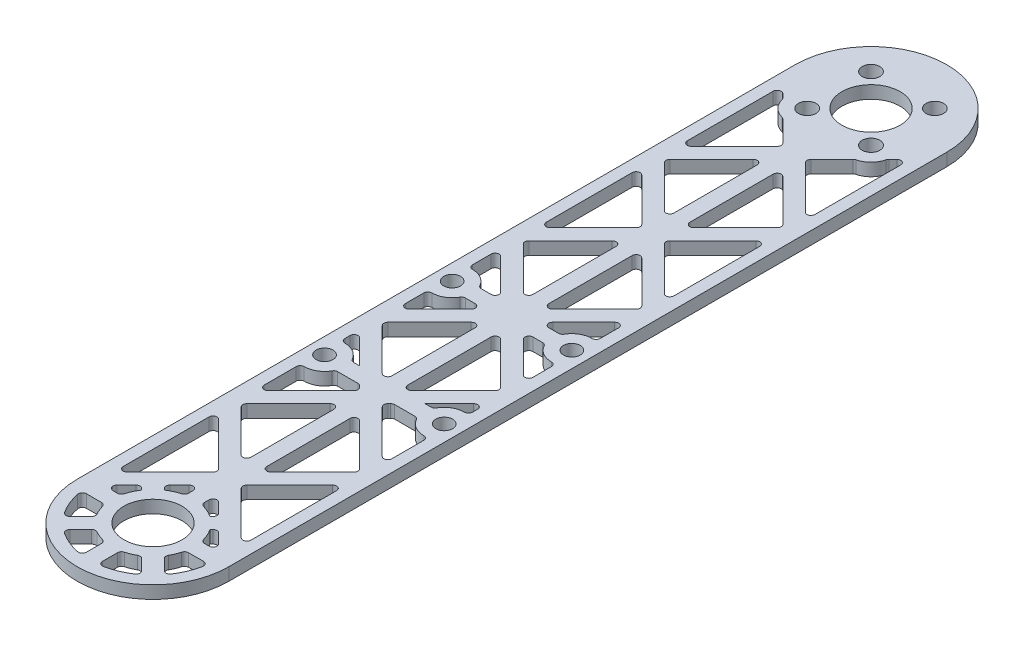
from build123d import *

# Parameters (mm, degrees)
SKETCH1_R           = 7.3
SKETCH1_R_2         = 2.2
SKETCH1_R_3         = 2.1
BOSS_EXTRUDE2_DEPTH = 3.175
CUT_EXTRUDE1_DEPTH  = 3.175


with BuildPart() as part:
    # Sketch1 → Boss-Extrude2 (new body)
    with BuildSketch(Plane(origin=(0, 0, 0), x_dir=(1, 0, 0), z_dir=(0, 1, 0))):
        with BuildLine():
            Line((-19, 90), (-19, -90))
            ThreePointArc((-19, -90), (0, -109), (19, -90))
            Line((19, -90), (19, 90))
            ThreePointArc((19, 90), (0, 109), (-19, 90))
        make_face()
        with Locations(Location((0, 90, 0), (0, 0, 270))):
            Circle(SKETCH1_R, mode=Mode.SUBTRACT)
        with Locations(Location((0, -90, 0), (0, 0, 270))):
            Circle(SKETCH1_R, mode=Mode.SUBTRACT)
        with Locations(Location((-8, 98, 0), (0, 0, 270))):
            Circle(SKETCH1_R_2, mode=Mode.SUBTRACT)
        with Locations(Location((8, 98, 0), (0, 0, 270))):
            Circle(SKETCH1_R_2, mode=Mode.SUBTRACT)
        with Locations(Location((-8, 82, 0), (0, 0, 270))):
            Circle(SKETCH1_R_2, mode=Mode.SUBTRACT)
        with Locations(Location((8, 82, 0), (0, 0, 270))):
            Circle(SKETCH1_R_2, mode=Mode.SUBTRACT)
        with Locations(Location((15, 0, 0), (0, 0, 270))):
            Circle(SKETCH1_R_3, mode=Mode.SUBTRACT)
        with Locations(Location((15, -32, 0), (0, 0, 270))):
            Circle(SKETCH1_R_3, mode=Mode.SUBTRACT)
        with Locations(Location((-15, 0, 0), (0, 0, 270))):
            Circle(SKETCH1_R_3, mode=Mode.SUBTRACT)
        with Locations(Location((-15, -32, 0), (0, 0, 270))):
            Circle(SKETCH1_R_3, mode=Mode.SUBTRACT)
    extrude(amount=BOSS_EXTRUDE2_DEPTH)

    # Sketch2 → Cut-Extrude1 (cut)
    with BuildSketch(Plane(origin=(0, 3.175, 0), x_dir=(1, 0, 0), z_dir=(0, 1, 0))):
        with BuildLine():
            Line((-16, 46.112698372), (-16, 24.597979746))
            ThreePointArc((-16, 24.597979746), (-15.382683432, 23.674100214), (-14.292893219, 23.890872965))
            Line((-14.292893219, 23.890872965), (-3.535533906, 34.648232278))
            ThreePointArc((-3.535533906, 34.648232278), (-3.242640687, 35.355339059), (-3.535533906, 36.062445841))
            Line((-3.535533906, 36.062445841), (-14.292893219, 46.819805153))
            ThreePointArc((-14.292893219, 46.819805153), (-15.382683432, 47.036577905), (-16, 46.112698372))
        make_face()
        with BuildLine():
            Line((-3.707106781, 28.819805153), (-14.142135624, 18.384776311))
            ThreePointArc((-14.142135624, 18.384776311), (-14.435028843, 17.67766953), (-14.142135624, 16.970562748))
            Line((-14.142135624, 16.970562748), (-3.707106781, 6.535533906))
            ThreePointArc((-3.707106781, 6.535533906), (-2.617316568, 6.318761155), (-2, 7.242640687))
            Line((-2, 7.242640687), (-2, 28.112698372))
            ThreePointArc((-2, 28.112698372), (-2.617316568, 29.036577905), (-3.707106781, 28.819805153))
        make_face()
        with BuildLine():
            Line((16, -10.757359313), (16, -6.1))
            ThreePointArc((16, -6.1), (15.707106781, -5.392893219), (15, -5.1))
            ThreePointArc((15, -5.1), (12.429183328, -4.404645461), (10.559397653, -2.508196721))
            ThreePointArc((10.559397653, -2.508196721), (10.19277301, -2.136344027), (9.68869131, -2))
            Line((9.68869131, -2), (7.242640687, -2))
            ThreePointArc((7.242640687, -2), (6.318761155, -2.617316568), (6.535533906, -3.707106781))
            Line((6.535533906, -3.707106781), (14.292893219, -11.464466094))
            ThreePointArc((14.292893219, -11.464466094), (15.382683432, -11.681238845), (16, -10.757359313))
        make_face()
        with BuildLine():
            Line((16, 10.757359313), (16, 6.1))
            ThreePointArc((16, 6.1), (15.707106781, 5.392893219), (15, 5.1))
            ThreePointArc((15, 5.1), (12.429183328, 4.404645461), (10.559397653, 2.508196721))
            ThreePointArc((10.559397653, 2.508196721), (10.19277301, 2.136344027), (9.68869131, 2))
            Line((9.68869131, 2), (7.242640687, 2))
            ThreePointArc((7.242640687, 2), (6.318761155, 2.617316568), (6.535533906, 3.707106781))
            Line((6.535533906, 3.707106781), (14.292893219, 11.464466094))
            ThreePointArc((14.292893219, 11.464466094), (15.382683432, 11.681238845), (16, 10.757359313))
        make_face()
        with BuildLine():
            Line((2, -7.242640687), (2, -28.112698372))
            ThreePointArc((2, -28.112698372), (2.617316568, -29.036577905), (3.707106781, -28.819805153))
            Line((3.707106781, -28.819805153), (14.142135624, -18.384776311))
            ThreePointArc((14.142135624, -18.384776311), (14.435028843, -17.67766953), (14.142135624, -16.970562748))
            Line((14.142135624, -16.970562748), (3.707106781, -6.535533906))
            ThreePointArc((3.707106781, -6.535533906), (2.617316568, -6.318761155), (2, -7.242640687))
        make_face()
        with BuildLine():
            Line((2, -42.597979747), (2, -63.468037432))
            ThreePointArc((2, -63.468037432), (2.617316568, -64.391916964), (3.707106781, -64.175144213))
            Line((3.707106781, -64.175144213), (14.142135624, -53.74011537))
            ThreePointArc((14.142135624, -53.74011537), (14.435028843, -53.033008589), (14.142135624, -52.325901808))
            Line((14.142135624, -52.325901808), (3.707106781, -41.890872965))
            ThreePointArc((3.707106781, -41.890872965), (2.617316568, -41.674100214), (2, -42.597979747))
        make_face()
        with BuildLine():
            Line((16, -59.953318806), (16, -81.468037431))
            ThreePointArc((16, -81.468037431), (15.382683432, -82.391916964), (14.292893219, -82.175144213))
            Line((14.292893219, -82.175144213), (3.535533906, -71.4177849))
            ThreePointArc((3.535533906, -71.4177849), (3.242640687, -70.710678119), (3.535533906, -70.003571337))
            Line((3.535533906, -70.003571337), (14.292893219, -59.246212025))
            ThreePointArc((14.292893219, -59.246212025), (15.382683432, -59.029439273), (16, -59.953318806))
        make_face()
        with BuildLine():
            Line((2, -77.953318806), (2, -79.105505978))
            ThreePointArc((2, -79.105505978), (2.204548328, -79.711523005), (2.734513274, -80.069620493))
            ThreePointArc((2.734513274, -80.069620493), (4.287639599, -80.634844013), (5.730364802, -81.441208074))
            Line((5.730364802, -81.441208074), (6.109127035, -81.062445841))
            ThreePointArc((6.109127035, -81.062445841), (6.402020254, -80.355339059), (6.109127035, -79.648232278))
            Line((6.109127035, -79.648232278), (3.707106781, -77.246212025))
            ThreePointArc((3.707106781, -77.246212025), (2.617316568, -77.029439273), (2, -77.953318806))
        make_face()
        with BuildLine():
            Line((8.937554159, -83.890872965), (8.558791926, -84.269635198))
            ThreePointArc((8.558791926, -84.269635198), (9.365155987, -85.712360401), (9.930379507, -87.265486726))
            ThreePointArc((9.930379507, -87.265486726), (10.288476995, -87.795451672), (10.894494022, -88))
            Line((10.894494022, -88), (12.046681194, -88))
            ThreePointArc((12.046681194, -88), (12.970560727, -87.382683432), (12.753787975, -86.292893219))
            Line((12.753787975, -86.292893219), (10.351767722, -83.890872965))
            ThreePointArc((10.351767722, -83.890872965), (9.644660941, -83.597979746), (8.937554159, -83.890872965))
        make_face()
        with BuildLine():
            Line((9.117784163, -96.289357038), (11.806518408, -98.978091283))
            ThreePointArc((11.806518408, -98.978091283), (12.614134151, -99.265920655), (13.347866868, -98.822383469))
            ThreePointArc((13.347866868, -98.822383469), (14.78207252, -96.122934918), (15.676734354, -93.2))
            ThreePointArc((15.676734354, -93.2), (15.471535126, -92.367544468), (14.696938457, -92))
            Line((14.696938457, -92), (10.894494022, -92))
            ThreePointArc((10.894494022, -92), (10.288476995, -92.204548328), (9.930379507, -92.734513274))
            ThreePointArc((9.930379507, -92.734513274), (9.515959185, -93.941639353), (8.955431569, -95.08824581))
            ThreePointArc((8.955431569, -95.08824581), (8.833902923, -95.716200779), (9.117784163, -96.289357038))
        make_face()
        with BuildLine():
            Line((2, -100.894494022), (2, -104.696938457))
            ThreePointArc((2, -104.696938457), (2.367544468, -105.471535126), (3.2, -105.676734354))
            ThreePointArc((3.2, -105.676734354), (6.122934918, -104.78207252), (8.822383469, -103.347866868))
            ThreePointArc((8.822383469, -103.347866868), (9.265920655, -102.614134151), (8.978091283, -101.806518408))
            Line((8.978091283, -101.806518408), (6.289357038, -99.117784163))
            ThreePointArc((6.289357038, -99.117784163), (5.716200779, -98.833902923), (5.08824581, -98.955431569))
            ThreePointArc((5.08824581, -98.955431569), (3.941639353, -99.515959185), (2.734513274, -99.930379507))
            ThreePointArc((2.734513274, -99.930379507), (2.204548328, -100.288476995), (2, -100.894494022))
        make_face()
        with BuildLine():
            Line((-3.707106781, -28.819805153), (-14.142135624, -18.384776311))
            ThreePointArc((-14.142135624, -18.384776311), (-14.435028843, -17.67766953), (-14.142135624, -16.970562748))
            Line((-14.142135624, -16.970562748), (-3.707106781, -6.535533906))
            ThreePointArc((-3.707106781, -6.535533906), (-2.617316568, -6.318761155), (-2, -7.242640687))
            Line((-2, -7.242640687), (-2, -28.112698372))
            ThreePointArc((-2, -28.112698372), (-2.617316568, -29.036577905), (-3.707106781, -28.819805153))
        make_face()
        with BuildLine():
            Line((-2, -42.597979747), (-2, -63.468037432))
            ThreePointArc((-2, -63.468037432), (-2.617316568, -64.391916964), (-3.707106781, -64.175144213))
            Line((-3.707106781, -64.175144213), (-14.142135624, -53.74011537))
            ThreePointArc((-14.142135624, -53.74011537), (-14.435028843, -53.033008589), (-14.142135624, -52.325901808))
            Line((-14.142135624, -52.325901808), (-3.707106781, -41.890872965))
            ThreePointArc((-3.707106781, -41.890872965), (-2.617316568, -41.674100214), (-2, -42.597979747))
        make_face()
        with BuildLine():
            Line((-14.292893219, -82.175144213), (-3.535533906, -71.4177849))
            ThreePointArc((-3.535533906, -71.4177849), (-3.242640687, -70.710678119), (-3.535533906, -70.003571337))
            Line((-3.535533906, -70.003571337), (-14.292893219, -59.246212025))
            ThreePointArc((-14.292893219, -59.246212025), (-15.382683432, -59.029439273), (-16, -59.953318806))
            Line((-16, -59.953318806), (-16, -81.468037431))
            ThreePointArc((-16, -81.468037431), (-15.382683432, -82.391916964), (-14.292893219, -82.175144213))
        make_face()
        with BuildLine():
            Line((-2, -77.953318806), (-2, -79.105505978))
            ThreePointArc((-2, -79.105505978), (-2.204548328, -79.711523005), (-2.734513274, -80.069620493))
            ThreePointArc((-2.734513274, -80.069620493), (-4.287639599, -80.634844013), (-5.730364802, -81.441208074))
            Line((-5.730364802, -81.441208074), (-6.109127035, -81.062445841))
            ThreePointArc((-6.109127035, -81.062445841), (-6.402020254, -80.355339059), (-6.109127035, -79.648232278))
            Line((-6.109127035, -79.648232278), (-3.707106781, -77.246212025))
            ThreePointArc((-3.707106781, -77.246212025), (-2.617316568, -77.029439273), (-2, -77.953318806))
        make_face()
        with BuildLine():
            Line((-2, -100.894494022), (-2, -104.696938457))
            ThreePointArc((-2, -104.696938457), (-2.367544468, -105.471535126), (-3.2, -105.676734354))
            ThreePointArc((-3.2, -105.676734354), (-6.122934918, -104.78207252), (-8.822383469, -103.347866868))
            ThreePointArc((-8.822383469, -103.347866868), (-9.265920655, -102.614134151), (-8.978091283, -101.806518408))
            Line((-8.978091283, -101.806518408), (-6.289357038, -99.117784163))
            ThreePointArc((-6.289357038, -99.117784163), (-5.716200779, -98.833902923), (-5.08824581, -98.955431569))
            ThreePointArc((-5.08824581, -98.955431569), (-3.941639353, -99.515959185), (-2.734513274, -99.930379507))
            ThreePointArc((-2.734513274, -99.930379507), (-2.204548328, -100.288476995), (-2, -100.894494022))
        make_face()
        with BuildLine():
            Line((-7.242640687, -2), (-9.68869131, -2))
            ThreePointArc((-9.68869131, -2), (-10.19277301, -2.136344027), (-10.559397653, -2.508196721))
            ThreePointArc((-10.559397653, -2.508196721), (-12.429183328, -4.404645461), (-15, -5.1))
            ThreePointArc((-15, -5.1), (-15.707106781, -5.392893219), (-16, -6.1))
            Line((-16, -6.1), (-16, -10.757359313))
            ThreePointArc((-16, -10.757359313), (-15.382683432, -11.681238845), (-14.292893219, -11.464466094))
            Line((-14.292893219, -11.464466094), (-6.535533906, -3.707106781))
            ThreePointArc((-6.535533906, -3.707106781), (-6.318761155, -2.617316568), (-7.242640687, -2))
        make_face()
        with BuildLine():
            Line((-16, 10.757359313), (-16, 6.1))
            ThreePointArc((-16, 6.1), (-15.707106781, 5.392893219), (-15, 5.1))
            ThreePointArc((-15, 5.1), (-12.429183328, 4.404645461), (-10.559397653, 2.508196721))
            ThreePointArc((-10.559397653, 2.508196721), (-10.19277301, 2.136344027), (-9.68869131, 2))
            Line((-9.68869131, 2), (-7.242640687, 2))
            ThreePointArc((-7.242640687, 2), (-6.318761155, 2.617316568), (-6.535533906, 3.707106781))
            Line((-6.535533906, 3.707106781), (-14.292893219, 11.464466094))
            ThreePointArc((-14.292893219, 11.464466094), (-15.382683432, 11.681238845), (-16, 10.757359313))
        make_face()
        with BuildLine():
            Line((-10.894494022, -92), (-14.696938457, -92))
            ThreePointArc((-14.696938457, -92), (-15.471535126, -92.367544468), (-15.676734354, -93.2))
            ThreePointArc((-15.676734354, -93.2), (-14.78207252, -96.122934918), (-13.347866868, -98.822383469))
            ThreePointArc((-13.347866868, -98.822383469), (-12.614134151, -99.265920655), (-11.806518408, -98.978091283))
            Line((-11.806518408, -98.978091283), (-9.117784163, -96.289357038))
            ThreePointArc((-9.117784163, -96.289357038), (-8.833902923, -95.716200779), (-8.955431569, -95.08824581))
            ThreePointArc((-8.955431569, -95.08824581), (-9.515959185, -93.941639353), (-9.930379507, -92.734513274))
            ThreePointArc((-9.930379507, -92.734513274), (-10.288476995, -92.204548328), (-10.894494022, -92))
        make_face()
        with BuildLine():
            Line((-8.937554159, -83.890872965), (-8.558791926, -84.269635198))
            ThreePointArc((-8.558791926, -84.269635198), (-9.365155987, -85.712360401), (-9.930379507, -87.265486726))
            ThreePointArc((-9.930379507, -87.265486726), (-10.288476995, -87.795451672), (-10.894494022, -88))
            Line((-10.894494022, -88), (-12.046681194, -88))
            ThreePointArc((-12.046681194, -88), (-12.970560727, -87.382683432), (-12.753787975, -86.292893219))
            Line((-12.753787975, -86.292893219), (-10.351767722, -83.890872965))
            ThreePointArc((-10.351767722, -83.890872965), (-9.644660941, -83.597979746), (-8.937554159, -83.890872965))
        make_face()
        with BuildLine():
            Line((-16, -24.597979746), (-16, -25.9))
            ThreePointArc((-16, -25.9), (-15.707106781, -26.607106781), (-15, -26.9))
            ThreePointArc((-15, -26.9), (-12.429183328, -27.595354539), (-10.559397653, -29.491803279))
            ThreePointArc((-10.559397653, -29.491803279), (-10.19277301, -29.863655973), (-9.68869131, -30))
            Line((-9.68869131, -30), (-8.183766184, -30))
            Line((-8.183766184, -30), (-14.292893219, -23.890872965))
            ThreePointArc((-14.292893219, -23.890872965), (-15.382683432, -23.674100214), (-16, -24.597979746))
        make_face()
        with BuildLine():
            Line((-9.68869131, -34), (-4.597979746, -34))
            ThreePointArc((-4.597979746, -34), (-4.215296314, -34.076120468), (-3.890872965, -34.292893219))
            Line((-3.890872965, -34.292893219), (-3.535533906, -34.648232278))
            ThreePointArc((-3.535533906, -34.648232278), (-3.242640687, -35.355339059), (-3.535533906, -36.062445841))
            Line((-3.535533906, -36.062445841), (-14.292893219, -46.819805153))
            ThreePointArc((-14.292893219, -46.819805153), (-15.382683432, -47.036577905), (-16, -46.112698372))
            Line((-16, -46.112698372), (-16, -38.1))
            ThreePointArc((-16, -38.1), (-15.707106781, -37.392893219), (-15, -37.1))
            ThreePointArc((-15, -37.1), (-12.429183328, -36.404645461), (-10.559397653, -34.508196721))
            ThreePointArc((-10.559397653, -34.508196721), (-10.19277301, -34.136344027), (-9.68869131, -34))
        make_face()
        with BuildLine():
            Line((16, -24.597979746), (16, -25.9))
            ThreePointArc((16, -25.9), (15.707106781, -26.607106781), (15, -26.9))
            ThreePointArc((15, -26.9), (12.429183328, -27.595354539), (10.559397653, -29.491803279))
            ThreePointArc((10.559397653, -29.491803279), (10.19277301, -29.863655973), (9.68869131, -30))
            Line((9.68869131, -30), (8.183766184, -30))
            Line((8.183766184, -30), (14.292893219, -23.890872965))
            ThreePointArc((14.292893219, -23.890872965), (15.382683432, -23.674100214), (16, -24.597979746))
        make_face()
        with BuildLine():
            Line((16, -46.112698372), (16, -38.1))
            ThreePointArc((16, -38.1), (15.707106781, -37.392893219), (15, -37.1))
            ThreePointArc((15, -37.1), (12.429183328, -36.404645461), (10.559397653, -34.508196721))
            ThreePointArc((10.559397653, -34.508196721), (10.19277301, -34.136344027), (9.68869131, -34))
            Line((9.68869131, -34), (4.597979746, -34))
            ThreePointArc((4.597979746, -34), (4.215296314, -34.076120468), (3.890872965, -34.292893219))
            Line((3.890872965, -34.292893219), (3.535533906, -34.648232278))
            ThreePointArc((3.535533906, -34.648232278), (3.242640687, -35.355339059), (3.535533906, -36.062445841))
            Line((3.535533906, -36.062445841), (14.292893219, -46.819805153))
            ThreePointArc((14.292893219, -46.819805153), (15.382683432, -47.036577905), (16, -46.112698372))
        make_face()
        with BuildLine():
            Line((-3.707106781, 64.175144213), (-14.142135624, 53.74011537))
            ThreePointArc((-14.142135624, 53.74011537), (-14.435028843, 53.033008589), (-14.142135624, 52.325901808))
            Line((-14.142135624, 52.325901808), (-3.707106781, 41.890872965))
            ThreePointArc((-3.707106781, 41.890872965), (-2.617316568, 41.674100214), (-2, 42.597979746))
            Line((-2, 42.597979746), (-2, 63.468037431))
            ThreePointArc((-2, 63.468037431), (-2.617316568, 64.391916964), (-3.707106781, 64.175144213))
        make_face()
        with BuildLine():
            Line((-16, 81.468037432), (-16, 59.953318806))
            ThreePointArc((-16, 59.953318806), (-15.382683432, 59.029439273), (-14.292893219, 59.246212025))
            Line((-14.292893219, 59.246212025), (-3.535533906, 70.003571337))
            ThreePointArc((-3.535533906, 70.003571337), (-3.242640687, 70.710678119), (-3.535533906, 71.4177849))
            Line((-3.535533906, 71.4177849), (-8.814462561, 76.696713555))
            ThreePointArc((-8.814462561, 76.696713555), (-9.02757948, 76.859074436), (-9.276154932, 76.959025036))
            ThreePointArc((-9.276154932, 76.959025036), (-11.676955262, 78.323044738), (-13.040974964, 80.723845068))
            ThreePointArc((-13.040974964, 80.723845068), (-13.140925564, 80.97242052), (-13.303286445, 81.185537439))
            Line((-13.303286445, 81.185537439), (-14.292893219, 82.175144213))
            ThreePointArc((-14.292893219, 82.175144213), (-15.382683432, 82.391916964), (-16, 81.468037432))
        make_face()
        with BuildLine():
            Line((14.142135624, 16.970562748), (3.707106781, 6.535533906))
            ThreePointArc((3.707106781, 6.535533906), (2.617316568, 6.318761155), (2, 7.242640687))
            Line((2, 7.242640687), (2, 28.112698372))
            ThreePointArc((2, 28.112698372), (2.617316568, 29.036577905), (3.707106781, 28.819805153))
            Line((3.707106781, 28.819805153), (14.142135624, 18.384776311))
            ThreePointArc((14.142135624, 18.384776311), (14.435028843, 17.67766953), (14.142135624, 16.970562748))
        make_face()
        with BuildLine():
            Line((14.292893219, 23.890872965), (3.535533906, 34.648232278))
            ThreePointArc((3.535533906, 34.648232278), (3.242640687, 35.355339059), (3.535533906, 36.062445841))
            Line((3.535533906, 36.062445841), (14.292893219, 46.819805153))
            ThreePointArc((14.292893219, 46.819805153), (15.382683432, 47.036577905), (16, 46.112698372))
            Line((16, 46.112698372), (16, 24.597979746))
            ThreePointArc((16, 24.597979746), (15.382683432, 23.674100214), (14.292893219, 23.890872965))
        make_face()
        with BuildLine():
            Line((14.142135624, 52.325901808), (3.707106781, 41.890872965))
            ThreePointArc((3.707106781, 41.890872965), (2.617316568, 41.674100214), (2, 42.597979746))
            Line((2, 42.597979746), (2, 63.468037431))
            ThreePointArc((2, 63.468037431), (2.617316568, 64.391916964), (3.707106781, 64.175144213))
            Line((3.707106781, 64.175144213), (14.142135624, 53.74011537))
            ThreePointArc((14.142135624, 53.74011537), (14.435028843, 53.033008589), (14.142135624, 52.325901808))
        make_face()
        with BuildLine():
            Line((14.292893219, 82.175144213), (13.303286445, 81.185537439))
            ThreePointArc((13.303286445, 81.185537439), (13.140925564, 80.97242052), (13.040974964, 80.723845068))
            ThreePointArc((13.040974964, 80.723845068), (11.676955262, 78.323044738), (9.276154932, 76.959025036))
            ThreePointArc((9.276154932, 76.959025036), (9.02757948, 76.859074436), (8.814462561, 76.696713555))
            Line((8.814462561, 76.696713555), (3.535533906, 71.4177849))
            ThreePointArc((3.535533906, 71.4177849), (3.242640687, 70.710678119), (3.535533906, 70.003571337))
            Line((3.535533906, 70.003571337), (14.292893219, 59.246212025))
            ThreePointArc((14.292893219, 59.246212025), (15.382683432, 59.029439273), (16, 59.953318806))
            Line((16, 59.953318806), (16, 81.468037432))
            ThreePointArc((16, 81.468037432), (15.382683432, 82.391916964), (14.292893219, 82.175144213))
        make_face()
    extrude(amount=-CUT_EXTRUDE1_DEPTH, mode=Mode.SUBTRACT)


solid = part.part
